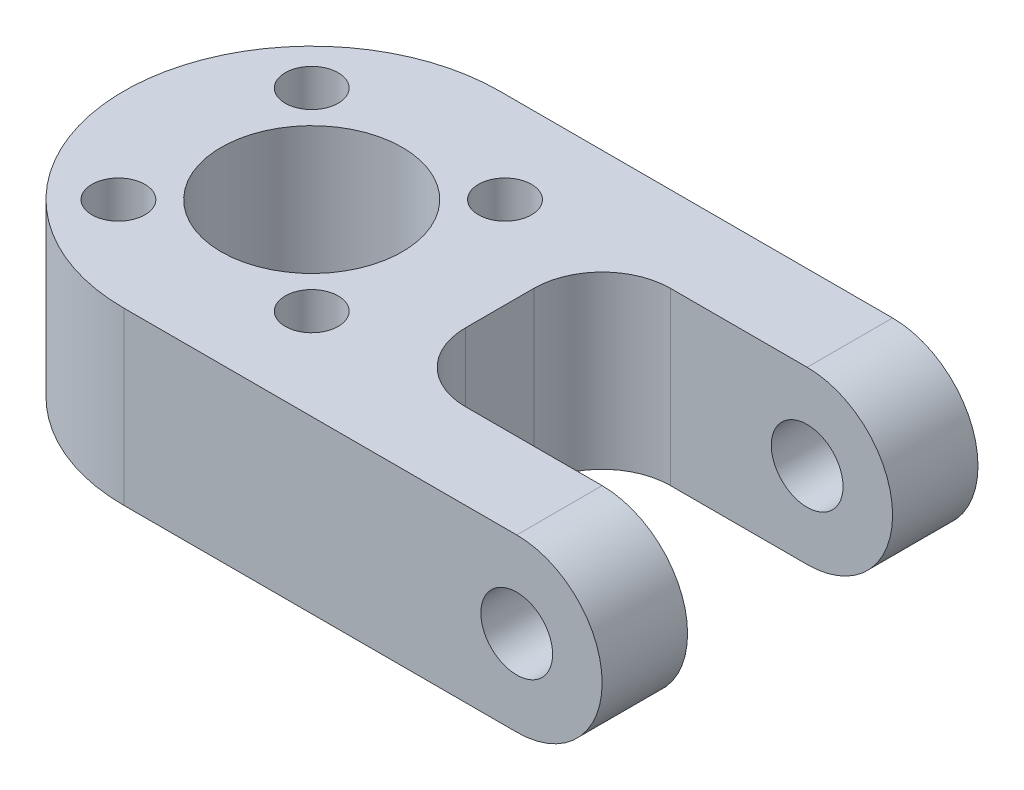
from build123d import *

# Parameters (mm, degrees)
SKETCH2_R           = 1.55
SKETCH2_R_2         = 5.3
BOSS_EXTRUDE2_DEPTH = 10
SKETCH7_R           = 2.1
CUT_EXTRUDE2_DEPTH  = 46.880278988
FILLET1_R           = 4


with BuildPart() as part:
    # Sketch2 → Boss-Extrude2 (new body)
    with BuildSketch(Plane(origin=(0, 0, 0), x_dir=(1, 0, 0), z_dir=(0, 1, 0))):
        with BuildLine():
            ThreePointArc((-28, 11), (-39, 0), (-28, -11))
            Line((-28, -11), (0, -11))
            Line((0, -11), (0, -6))
            Line((0, -6), (-17, -6))
            Line((-17, -6), (-17, 6))
            Line((-17, 6), (0, 6))
            Line((0, 6), (0, 11))
            Line((0, 11), (-28, 11))
        make_face()
        with Locations((-33.656854249, -5.656854249)):
            Circle(SKETCH2_R, mode=Mode.SUBTRACT)
        with Locations((-22.343145751, -5.656854249)):
            Circle(SKETCH2_R, mode=Mode.SUBTRACT)
        with Locations((-28, 0)):
            Circle(SKETCH2_R_2, mode=Mode.SUBTRACT)
        with Locations((-33.656854249, 5.656854249)):
            Circle(SKETCH2_R, mode=Mode.SUBTRACT)
        with Locations((-22.343145751, 5.656854249)):
            Circle(SKETCH2_R, mode=Mode.SUBTRACT)
    extrude(amount=BOSS_EXTRUDE2_DEPTH)

    # Sketch7 → Cut-Extrude2 (cut, through all)
    with BuildSketch(Plane.XY.offset(11)):
        with BuildLine():
            Line((0, 10), (-5, 10))
            ThreePointArc((-5, 10), (-1.464466094, 8.535533906), (0, 5))
            Line((0, 5), (0, 10))
        make_face()
        with BuildLine():
            Line((0, 0), (0, 5))
            ThreePointArc((0, 5), (-1.464466094, 1.464466094), (-5, 0))
            Line((-5, 0), (0, 0))
        make_face()
        with Locations((-5, 5)):
            Circle(SKETCH7_R)
    extrude(amount=-CUT_EXTRUDE2_DEPTH, mode=Mode.SUBTRACT)

    # Fillet1
    fillet1_edges = [part.edges().sort_by_distance(p)[0] for p in [
        (-17, 5, -6),
        (-17, 5, 6),
    ]]
    fillet(fillet1_edges, radius=FILLET1_R)


solid = part.part
